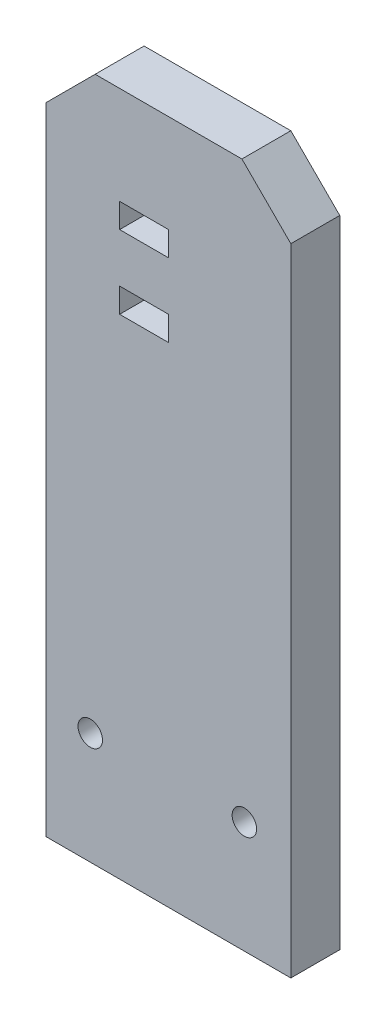
from build123d import *

# Parameters (mm, degrees)
SKETCH1_W           = 50
SKETCH1_H           = 140
SKETCH1_R           = 2.5
SKETCH1_W_2         = 10
SKETCH1_H_2         = 5
BOSS_EXTRUDE1_DEPTH = 5
CHAMFER1_SIZE       = 10


with BuildPart() as part:
    # Sketch1 → Boss-Extrude1 (new, symmetric)
    with BuildSketch(Plane.XY):
        with Locations((0, 70)):
            Rectangle(SKETCH1_W, SKETCH1_H)
        with Locations((-16, 22.85)):
            Circle(SKETCH1_R, mode=Mode.SUBTRACT)
        with Locations((15.5, 22.85)):
            Circle(SKETCH1_R, mode=Mode.SUBTRACT)
        with Locations((-5, 102.5)):
            Rectangle(SKETCH1_W_2, SKETCH1_H_2, mode=Mode.SUBTRACT)
        with Locations((-5, 117.5)):
            Rectangle(SKETCH1_W_2, SKETCH1_H_2, mode=Mode.SUBTRACT)
    extrude(amount=BOSS_EXTRUDE1_DEPTH, both=True)

    # Chamfer1
    chamfer1_edges = [part.edges().sort_by_distance(p)[0] for p in [
        (-25, 140, 0),
        (25, 140, 0),
    ]]
    chamfer(chamfer1_edges, length=CHAMFER1_SIZE)


solid = part.part
